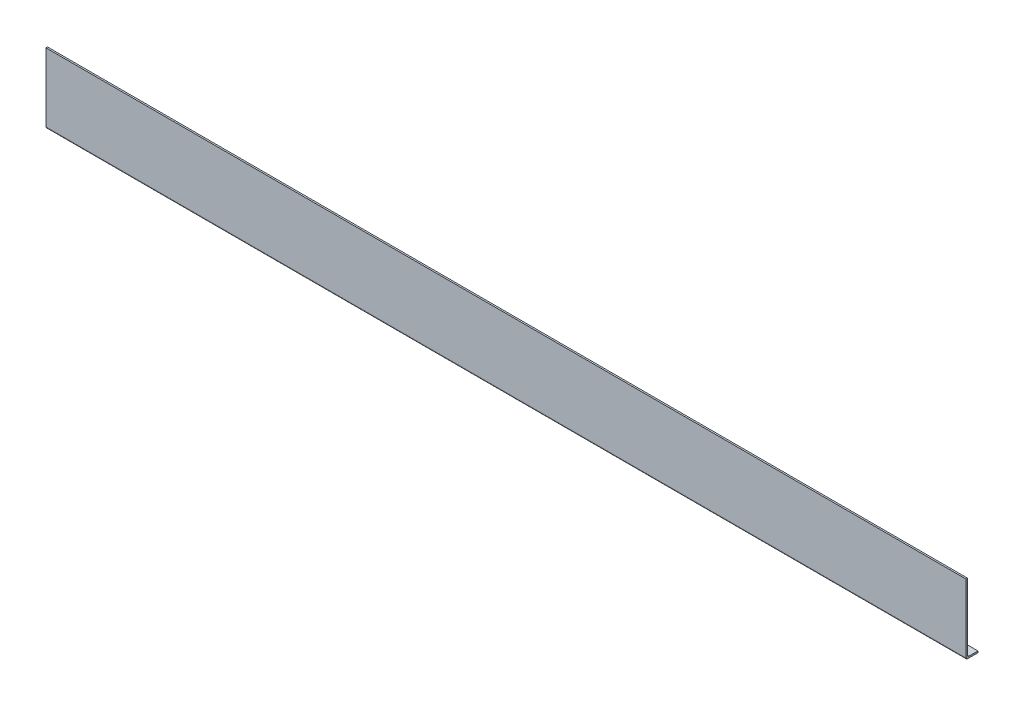
from build123d import *

# Parameters (mm, degrees)
BOSS_EXTRUDE1_DEPTH = 1750
FILLET1_R           = 3


with BuildPart() as part:
    # Sketch1 → Boss-Extrude1 (new body)
    with BuildSketch(Plane(origin=(0, 0, 0), x_dir=(0, 0, -1), z_dir=(1, 0, 0))):
        Polygon((0, 0), (-23, 0), (-23, 133), (-20, 133), (-20, 3), (0, 3), align=None)
    extrude(amount=BOSS_EXTRUDE1_DEPTH)

    # Fillet1
    fillet1_edges = [part.edges().sort_by_distance(p)[0] for p in [
        (875, 0, 23),
        (875, 3, 20),
    ]]
    fillet(fillet1_edges, radius=FILLET1_R)


solid = part.part
